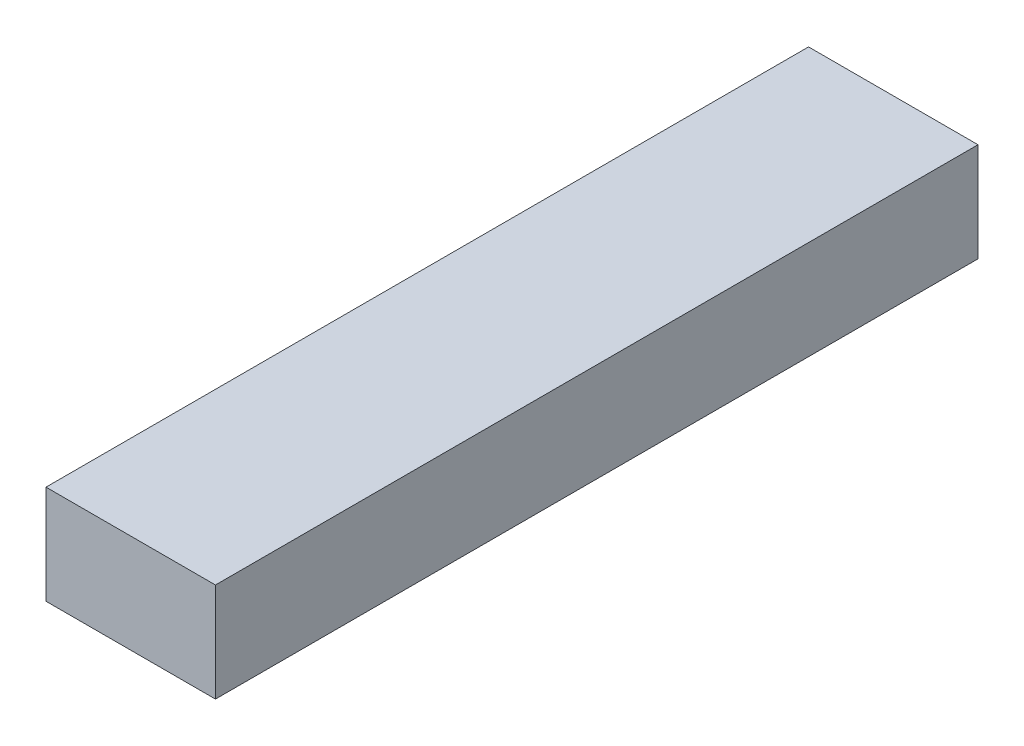
from build123d import *

# Parameters (mm, degrees)
SKETCH1_W           = 304.8
SKETCH1_H           = 177.8
BOSS_EXTRUDE1_DEPTH = 1371.6


with BuildPart() as part:
    # Sketch1 → Boss-Extrude1 (new body)
    with BuildSketch(Plane.XY):
        Rectangle(SKETCH1_W, SKETCH1_H)
    extrude(amount=BOSS_EXTRUDE1_DEPTH)


solid = part.part
